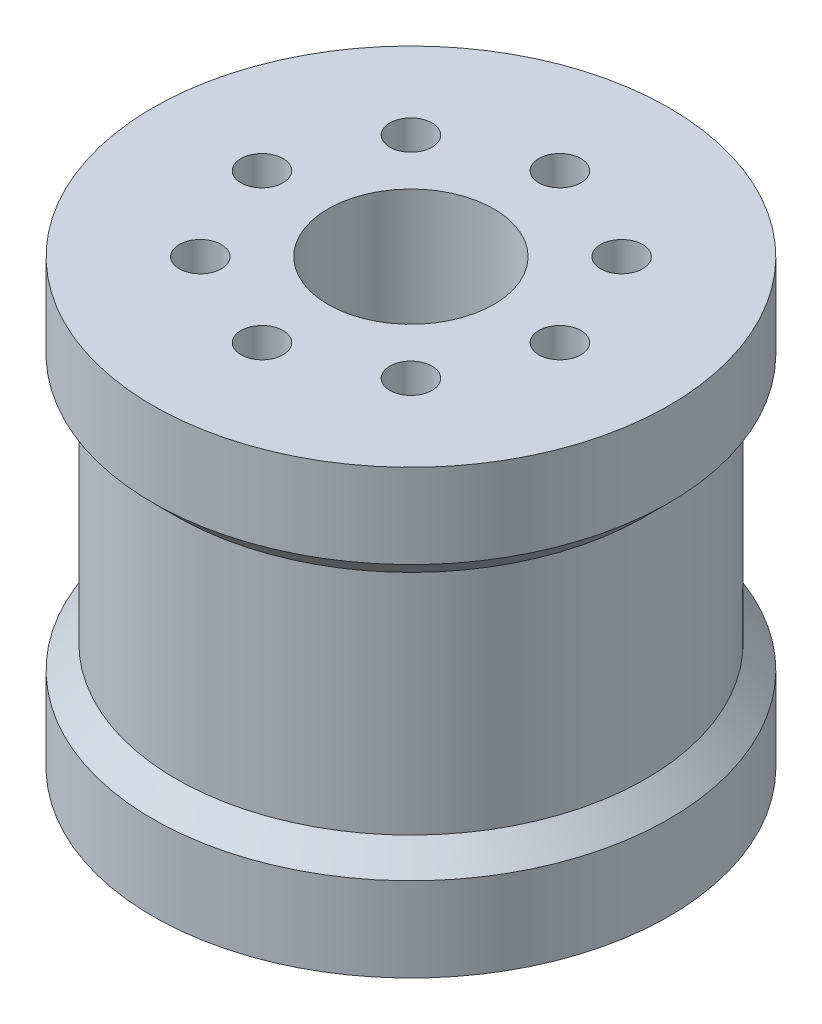
from build123d import *

# Parameters (mm, degrees)
SKETCH2_R          = 3.935
SKETCH2_R_2        = 1
CUT_EXTRUDE1_DEPTH = 45


with BuildPart() as part:
    # Sketch1 → Revolve1 (revolve)
    with BuildSketch(Plane.XY, mode=Mode.PRIVATE) as revolve1_sk:
        Polygon((-3, 0), (-3, 21), (-12.25, 21), (-12.25, 17), (-11.15, 15.9), (-11.15, 5.1), (-12.25, 4), (-12.25, 0), align=None)
    revolve(revolve1_sk.sketch.rotate(Axis((0, 0, 0), (0, 1, 0)), 270), axis=Axis((0, 0, 0), (0, 1, 0)))

    # Sketch2 → Cut-Extrude1 (cut)
    with BuildSketch(Plane(origin=(0, 21, 0), x_dir=(1, 0, 0), z_dir=(0, 1, 0))):
        with Locations(Location((0, 0, 0), (0, 0, 270))):
            Circle(SKETCH2_R)
        with Locations(Location((-5, 5, 0), (0, 0, 270))):
            Circle(SKETCH2_R_2)
        with Locations(Location((5, 5, 0), (0, 0, 270))):
            Circle(SKETCH2_R_2)
        with Locations(Location((5, -5, 0), (0, 0, 270))):
            Circle(SKETCH2_R_2)
        with Locations(Location((-5, -5, 0), (0, 0, 270))):
            Circle(SKETCH2_R_2)
        with Locations(Location((-7.071067812, 0, 0), (0, 0, 270))):
            Circle(SKETCH2_R_2)
        with Locations(Location((0, 7.071067812, 0), (0, 0, 270))):
            Circle(SKETCH2_R_2)
        with Locations(Location((7.071067812, 0, 0), (0, 0, 270))):
            Circle(SKETCH2_R_2)
        with Locations(Location((0, -7.071067812, 0), (0, 0, 270))):
            Circle(SKETCH2_R_2)
    extrude(amount=-CUT_EXTRUDE1_DEPTH, mode=Mode.SUBTRACT)


solid = part.part
